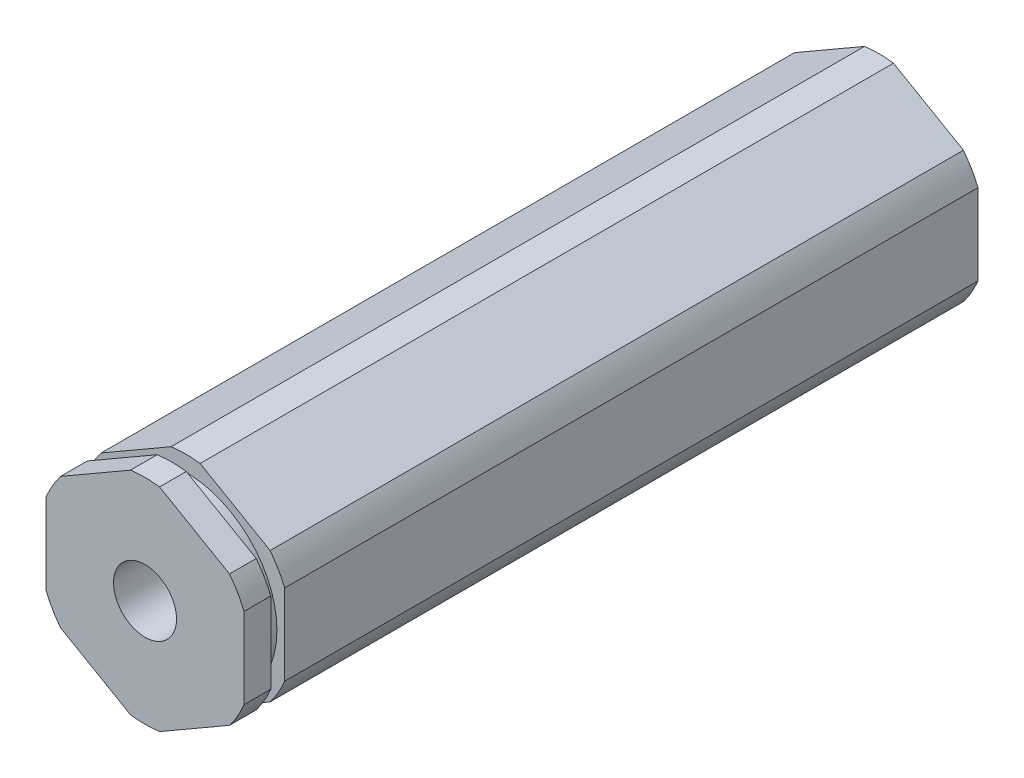
from build123d import *

# Parameters (mm, degrees)
BOSS_EXTRUDE1_DEPTH                  = 23.5331
F_10_32_TAPPED_HOLE1_D               = 4.0386
F_10_32_TAPPED_HOLE1_DEPTH           = 16.34744
F_10_32_TAPPED_HOLE1_TIP             = 1.213317848
F_10_32_TAPPED_HOLE1_ON_FACE_2_D     = 4.0386
F_10_32_TAPPED_HOLE1_ON_FACE_2_DEPTH = 16.34744
F_10_32_TAPPED_HOLE1_ON_FACE_2_TIP   = 1.213317848
SKETCH5_W                            = 0.889
SKETCH5_H                            = 1.0033


with BuildPart() as part:
    # Sketch1 → Boss-Extrude1 (new, symmetric)
    with BuildSketch(Plane.XY):
        with BuildLine():
            ThreePointArc((0.93173274, 6.79441227), (0, 6.858), (-0.93173274, 6.79441227))
            Line((-0.93173274, 6.79441227), (-5.41826726, 4.204110358))
            ThreePointArc((-5.41826726, 4.204110358), (-5.939202219, 3.429), (-6.35, 2.590301913))
            Line((-6.35, 2.590301913), (-6.35, -2.590301913))
            ThreePointArc((-6.35, -2.590301913), (-5.939202219, -3.429), (-5.41826726, -4.204110358))
            Line((-5.41826726, -4.204110358), (-0.93173274, -6.79441227))
            ThreePointArc((-0.93173274, -6.79441227), (0, -6.858), (0.93173274, -6.79441227))
            Line((0.93173274, -6.79441227), (5.41826726, -4.204110358))
            ThreePointArc((5.41826726, -4.204110358), (5.939202219, -3.429), (6.35, -2.590301913))
            Line((6.35, -2.590301913), (6.35, 2.590301913))
            ThreePointArc((6.35, 2.590301913), (5.939202219, 3.429), (5.41826726, 4.204110358))
            Line((5.41826726, 4.204110358), (0.93173274, 6.79441227))
        make_face()
    extrude(amount=BOSS_EXTRUDE1_DEPTH, both=True)

    # #10-32 Tapped Hole1
    with Locations(Plane.XY.offset(23.5331)):
        with Locations((0, 0)):
            Hole(F_10_32_TAPPED_HOLE1_D / 2, depth=F_10_32_TAPPED_HOLE1_DEPTH)
            with Locations((0, 0, -(F_10_32_TAPPED_HOLE1_DEPTH + F_10_32_TAPPED_HOLE1_TIP / 2))):  # 118° drill point
                Cone(0, F_10_32_TAPPED_HOLE1_D / 2, F_10_32_TAPPED_HOLE1_TIP, mode=Mode.SUBTRACT)

    # #10-32 Tapped Hole1 on face 2
    with Locations(Plane(origin=(0, 0, -23.5331), x_dir=(-1, 0, 0), z_dir=(0, 0, -1))):
        with Locations((0, 0)):
            Hole(F_10_32_TAPPED_HOLE1_ON_FACE_2_D / 2, depth=F_10_32_TAPPED_HOLE1_ON_FACE_2_DEPTH)
            with Locations((0, 0, -(F_10_32_TAPPED_HOLE1_ON_FACE_2_DEPTH + F_10_32_TAPPED_HOLE1_ON_FACE_2_TIP / 2))):  # 118° drill point
                Cone(0, F_10_32_TAPPED_HOLE1_ON_FACE_2_D / 2, F_10_32_TAPPED_HOLE1_ON_FACE_2_TIP, mode=Mode.SUBTRACT)

    # Sketch5 → Cut-Revolve1 (revolve, cut)
    with BuildSketch(Plane(origin=(0, 0, 0), x_dir=(0, 0, -1), z_dir=(1, 0, 0)), mode=Mode.PRIVATE) as cut_revolve1_sk:
        with Locations((-21.3741, 6.35635)):
            Rectangle(SKETCH5_W, SKETCH5_H)
    revolve(cut_revolve1_sk.sketch.rotate(Axis((0, 0, 165.047176272), (0, 0, -1)), 90), axis=Axis((0, 0, 165.047176272), (0, 0, -1)), mode=Mode.SUBTRACT)


solid = part.part
